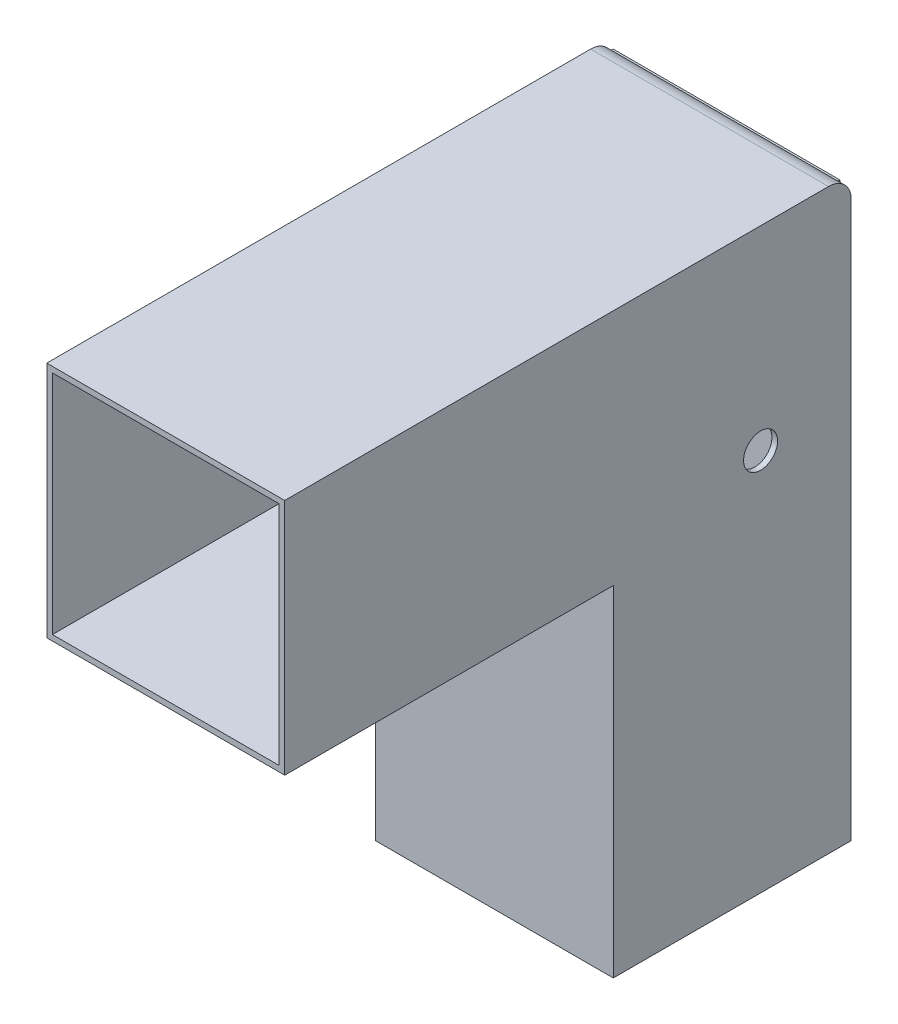
from build123d import *

# Parameters (mm, degrees)
ESQUISSE1_W             = 21
ESQUISSE1_H             = 21
BOSS_EXTRU_1_DEPTH      = 50
ESQUISSE3_W             = 21
ESQUISSE3_H             = 21
BOSS_EXTRU_2_DEPTH      = 30
COQUE1_T                = -0.5
CONG_1_R                = 2
ESQUISSE4_R             = 1.5
ENL_V_MAT_EXTRU_1_DEPTH = 68.684931853


with BuildPart() as part:
    # Esquisse1 → Boss.-Extru.1 (new body)
    with BuildSketch(Plane.XY):
        Rectangle(ESQUISSE1_W, ESQUISSE1_H)
    extrude(amount=BOSS_EXTRU_1_DEPTH)

    # Esquisse3 → Boss.-Extru.2 (add)
    with BuildSketch(Plane.XZ.offset(10.5)):
        with Locations((0, 10.5)):
            Rectangle(ESQUISSE3_W, ESQUISSE3_H)
    extrude(amount=BOSS_EXTRU_2_DEPTH)

    # Coque1
    coque1_openings = [part.faces().sort_by_distance(p)[0] for p in [
        (0, 0, 50),
        (0, -40.5, 10.5),
    ]]
    offset(amount=COQUE1_T, openings=coque1_openings, kind=Kind.INTERSECTION)

    # Congé1
    cong_1_edges = [part.edges().sort_by_distance(p)[0] for p in [
        (0, 10.5, 0),
    ]]
    fillet(cong_1_edges, radius=CONG_1_R)

    # Esquisse4 → Enlèv. mat.-Extru.1 (cut, through all)
    with BuildSketch(Plane.ZY.offset(10.5)):
        with Locations(Location((8, -6.690777593, 0), (0, 0, 270))):
            Circle(ESQUISSE4_R)
    extrude(amount=-ENL_V_MAT_EXTRU_1_DEPTH, mode=Mode.SUBTRACT)


solid = part.part
